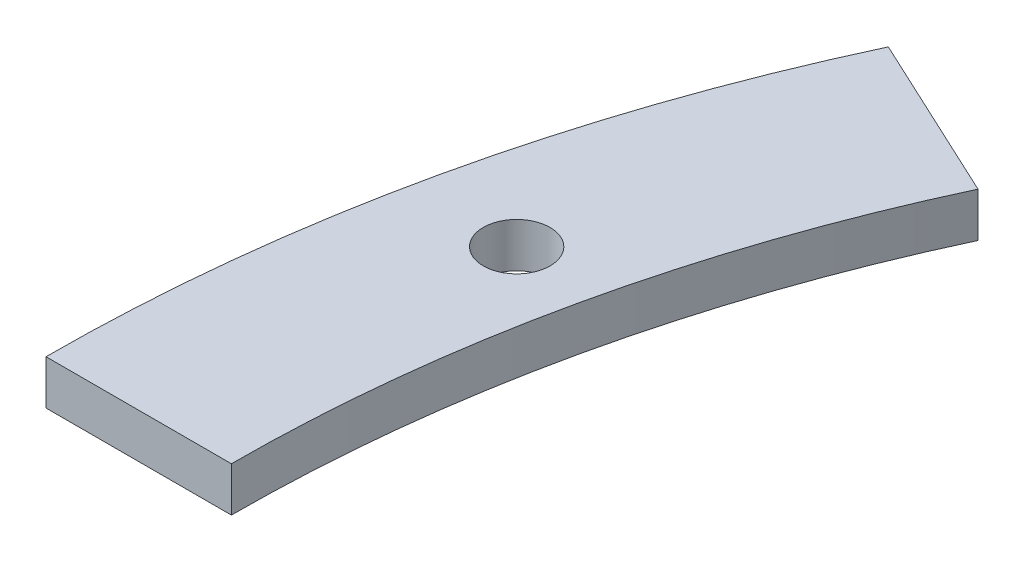
from build123d import *

# Parameters (mm, degrees)
ESTRUSIONE_ESTRUSIONE1_DEPTH = 3
FORO_PER_VITE_M4_1_D         = 4.5
FORO_PER_VITE_M4_1_DEPTH     = 9
FORO_PER_VITE_M4_1_TIP       = 1.351936393


with BuildPart() as part:
    # Schizzo1 → Estrusione-Estrusione1 (new body)
    with BuildSketch(Plane(origin=(0, 0, 0), x_dir=(1, 0, 0), z_dir=(0, 1, 0))):
        with BuildLine():
            Line((-99.693856574, 46.488008791), (-88.365009236, 41.20528052))
            ThreePointArc((-88.365009236, 41.20528052), (-95.188860694, 21.102862359), (-97.5, 0))
            Line((-97.5, 0), (-110, 0))
            ThreePointArc((-110, 0), (-107.392560783, 23.808357533), (-99.693856574, 46.488008791))
        make_face()
    extrude(amount=ESTRUSIONE_ESTRUSIONE1_DEPTH)

    # Foro per Vite M4-1
    with Locations(Plane(origin=(0, 3, 0), x_dir=(1, 0, 0), z_dir=(0, 1, 0))):
        with Locations((-100.558488733, 22.293280236)):
            Hole(FORO_PER_VITE_M4_1_D / 2, depth=FORO_PER_VITE_M4_1_DEPTH)
            with Locations((0, 0, -(FORO_PER_VITE_M4_1_DEPTH + FORO_PER_VITE_M4_1_TIP / 2))):  # 118° drill point
                Cone(0, FORO_PER_VITE_M4_1_D / 2, FORO_PER_VITE_M4_1_TIP, mode=Mode.SUBTRACT)


solid = part.part
